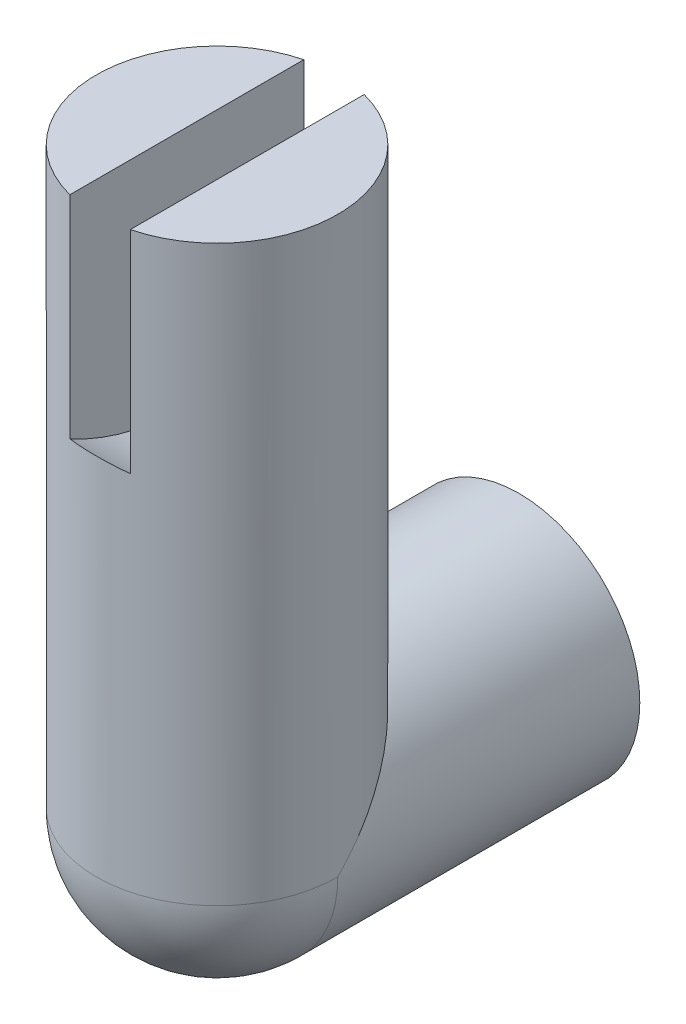
from build123d import *

# Parameters (mm, degrees)
CROQUIS1_R              = 4
SALIENTE_EXTRUIR1_DEPTH = 10
CROQUIS3_R              = 3
CORTAR_EXTRUIR2_DEPTH   = 5
CROQUIS4_W              = 4
CROQUIS4_H              = 19
CROQUIS5_W              = 2
CROQUIS5_H              = 8


with BuildPart() as part:
    # Croquis1 → Saliente-Extruir1 (new body)
    with BuildSketch(Plane.XY):
        with Locations((0, 44.649122807)):
            Circle(CROQUIS1_R)
    extrude(amount=-SALIENTE_EXTRUIR1_DEPTH)

    # Croquis3 → Cortar-Extruir2 (cut)
    with BuildSketch(Plane(origin=(0, 0, -10), x_dir=(-1, 0, 0), z_dir=(0, 0, -1))):
        with Locations((0, 44.649122807)):
            Circle(CROQUIS3_R)
    extrude(amount=-CORTAR_EXTRUIR2_DEPTH, mode=Mode.SUBTRACT)

    # Croquis4 → Revolución1 (revolve)
    with BuildSketch(Plane(origin=(0, 0, 0), x_dir=(0, 0, -1), z_dir=(1, 0, 0)), mode=Mode.PRIVATE) as revoluci_n1_sk:
        with Locations((-2, 54.149122807)):
            Rectangle(CROQUIS4_W, CROQUIS4_H)
    revolve(revoluci_n1_sk.sketch.rotate(Axis((0, 44.649122807, 0), (0, 1, 0)), 180), axis=Axis((0, 44.649122807, 0), (0, 1, 0)))

    # Croquis5 → Cortar-Revolución1 (revolve, cut)
    with BuildSketch(Plane(origin=(0, 63.649122807, 0), x_dir=(1, 0, 0), z_dir=(0, 1, 0))):
        with Locations((0, 4)):
            Rectangle(CROQUIS5_W, CROQUIS5_H)
    revolve(axis=Axis((1, 63.649122807, 0), (-1, 0, 0)), mode=Mode.SUBTRACT)

    # Croquis6 → Revolución3 (revolve)
    with BuildSketch(Plane.XZ.offset(-44.649122807)):
        with BuildLine():
            Line((-4, 0), (4, 0))
            ThreePointArc((4, 0), (0, 4), (-4, 0))
        make_face()
    revolve(axis=Axis((-4, 44.649122807, 0), (1, 0, 0)))


solid = part.part
